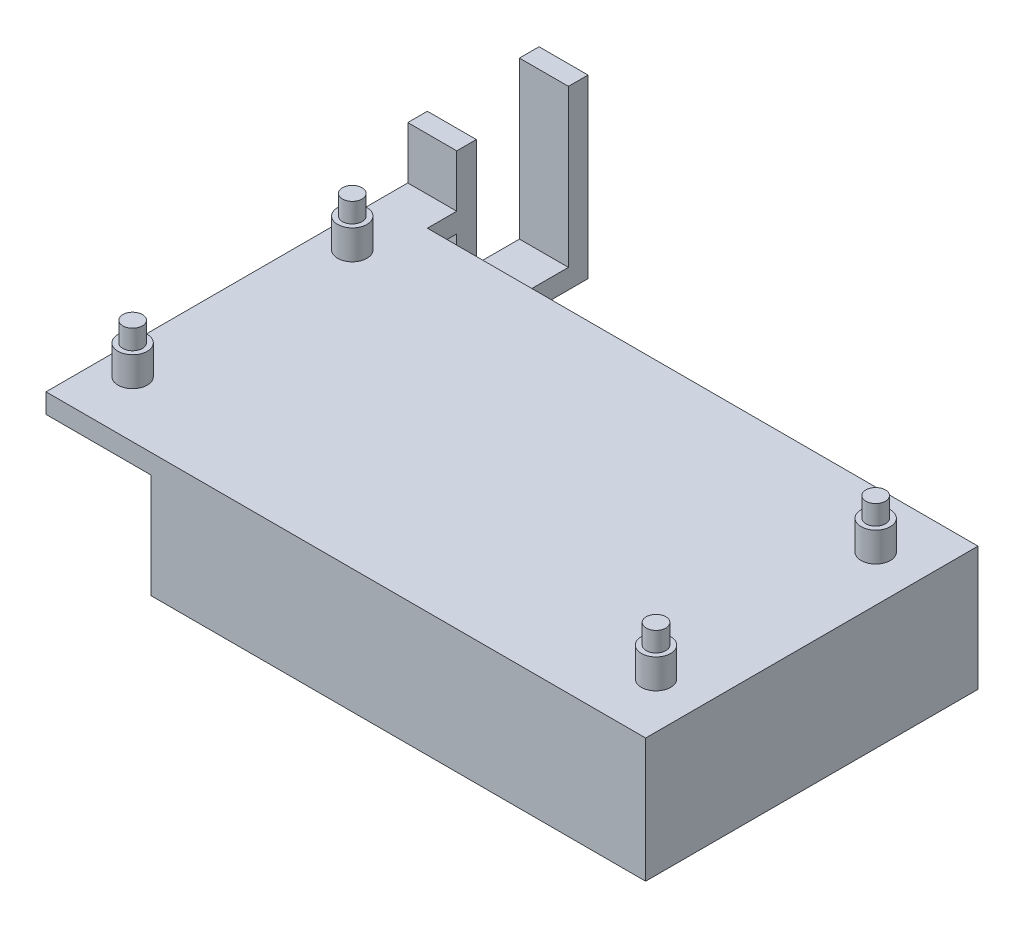
from build123d import *

# Parameters (mm, degrees)
SKETCH1_W            = 43.08
SKETCH1_H            = 16.08
SKETCH1_W_2          = 38
SKETCH1_H_2          = 11
BOSS_EXTRUDE1_DEPTH  = 57.785
SKETCH1_2_W          = 43.08
SKETCH1_2_H          = 16.08
BOSS_EXTRUDE2_DEPTH  = 2.54
CUT_EXTRUDE2_DEPTH   = 2.54
SKETCH5_W            = 72.136
SKETCH5_H            = 43.08
BOSS_EXTRUDE8_DEPTH  = 2.54
SKETCH5_6_R          = 1.27
BOSS_EXTRUDE9_DEPTH  = 6.35
SKETCH5_8_R          = 1.896612794
SKETCH5_8_R_2        = 1.27
BOSS_EXTRUDE10_DEPTH = 3.81
SKETCH6_W            = 43.08
SKETCH6_H            = 16.08
BOSS_EXTRUDE11_DEPTH = 3.81
SKETCH7_W            = 43.08
SKETCH7_H            = 2.54
BOSS_EXTRUDE12_DEPTH = 1.778
SKETCH8_W            = 3.81
SKETCH8_H            = 2.54
BOSS_EXTRUDE15_DEPTH = 6.35
BOSS_EXTRUDE16_DEPTH = 6.35


with BuildPart() as part:
    # Sketch1 → Boss-Extrude1 (new body)
    with BuildSketch(Plane(origin=(0, 0, 0), x_dir=(0, 0, -1), z_dir=(1, 0, 0))):
        Rectangle(SKETCH1_W, SKETCH1_H)
        Rectangle(SKETCH1_W_2, SKETCH1_H_2, mode=Mode.SUBTRACT)
    extrude(amount=-BOSS_EXTRUDE1_DEPTH)

    # Sketch1<2> → Boss-Extrude2 (add)
    with BuildSketch(Plane(origin=(0, 0, 0), x_dir=(0, 0, -1), z_dir=(1, 0, 0))):
        Rectangle(SKETCH1_2_W, SKETCH1_2_H)
    extrude(amount=BOSS_EXTRUDE2_DEPTH)

    # Sketch3 → Cut-Extrude2 (cut)
    with BuildSketch(Plane(origin=(0, 0, -21.54), x_dir=(-1, 0, 0), z_dir=(0, 0, -1))):
        Polygon((55.245, 2.921), (55.245, -5.5), (57.785, -5.5), (57.785, 2.96), (57.785, 5.5), (55.245, 5.5), align=None)
    extrude(amount=-CUT_EXTRUDE2_DEPTH, mode=Mode.SUBTRACT)

    # Sketch5 → Boss-Extrude8 (add)
    with BuildSketch(Plane(origin=(0, 8.04, 0), x_dir=(1, 0, 0), z_dir=(0, 1, 0))):
        with Locations((-33.528, 0)):
            Rectangle(SKETCH5_W, SKETCH5_H)
    extrude(amount=-BOSS_EXTRUDE8_DEPTH)

    # Sketch5<6> → Boss-Extrude9 (add)
    with BuildSketch(Plane(origin=(0, 8.04, 0), x_dir=(1, 0, 0), z_dir=(0, 1, 0))):
        with Locations((-67.4497, 14.236700027)):
            Circle(SKETCH5_6_R)
        with Locations((-67.4497, -14.236700027)):
            Circle(SKETCH5_6_R)
        with Locations((0.3937, -14.236700027)):
            Circle(SKETCH5_6_R)
        with Locations((0.3937, 14.236700027)):
            Circle(SKETCH5_6_R)
    extrude(amount=BOSS_EXTRUDE9_DEPTH)

    # Sketch5<8> → Boss-Extrude10 (add)
    # profile 1 of 4: a face of its own
    with BuildSketch(Plane(origin=(0, 8.04, 0), x_dir=(1, 0, 0), z_dir=(0, 1, 0))):
        with Locations((-67.4497, -14.236700027)):
            Circle(SKETCH5_8_R)
    # profile 2 of 4: a face of its own
    with BuildSketch(Plane(origin=(0, 8.04, 0), x_dir=(1, 0, 0), z_dir=(0, 1, 0))):
        with Locations((0.3937, -14.236700027)):
            Circle(SKETCH5_8_R)
    # profile 3 of 4: a face of its own
    with BuildSketch(Plane(origin=(0, 8.04, 0), x_dir=(1, 0, 0), z_dir=(0, 1, 0))):
        with Locations((0.3937, 14.236700027)):
            Circle(SKETCH5_8_R)
    # profile 4 of 4: a face of its own
    with BuildSketch(Plane(origin=(0, 8.04, 0), x_dir=(1, 0, 0), z_dir=(0, 1, 0))):
        with Locations((-67.4497, 14.236700027)):
            Circle(SKETCH5_8_R)
        with Locations((-67.4497, 14.236700027)):
            Circle(SKETCH5_8_R_2, mode=Mode.SUBTRACT)
    extrude(amount=BOSS_EXTRUDE10_DEPTH)

    # Sketch6 → Boss-Extrude11 (add)
    with BuildSketch(Plane(origin=(2.54, 0, 0), x_dir=(0, 0, -1), z_dir=(1, 0, 0))):
        Rectangle(SKETCH6_W, SKETCH6_H)
    extrude(amount=BOSS_EXTRUDE11_DEPTH)

    # Sketch7 → Boss-Extrude12 (add)
    with BuildSketch(Plane.ZY.offset(69.596)):
        with Locations((0, 6.77)):
            Rectangle(SKETCH7_W, SKETCH7_H)
    extrude(amount=BOSS_EXTRUDE12_DEPTH)

    # Sketch8 → Boss-Extrude15 (add)
    with BuildSketch(Plane.ZY.offset(71.374)):
        with Locations((-23.445, 6.77)):
            Rectangle(SKETCH8_W, SKETCH8_H)
    extrude(amount=-BOSS_EXTRUDE15_DEPTH)

    # Sketch8<5> → Boss-Extrude16 (add)
    with BuildSketch(Plane.ZY.offset(71.374)):
        Polygon((-25.35, 14.82), (-27.89, 14.82), (-27.89, -5.5), (-39.828, -5.5), (-39.828, 14.82), (-42.368, 14.82), (-42.368, -8.04), (-25.35, -8.04), align=None)
    extrude(amount=-BOSS_EXTRUDE16_DEPTH)


solid = part.part
